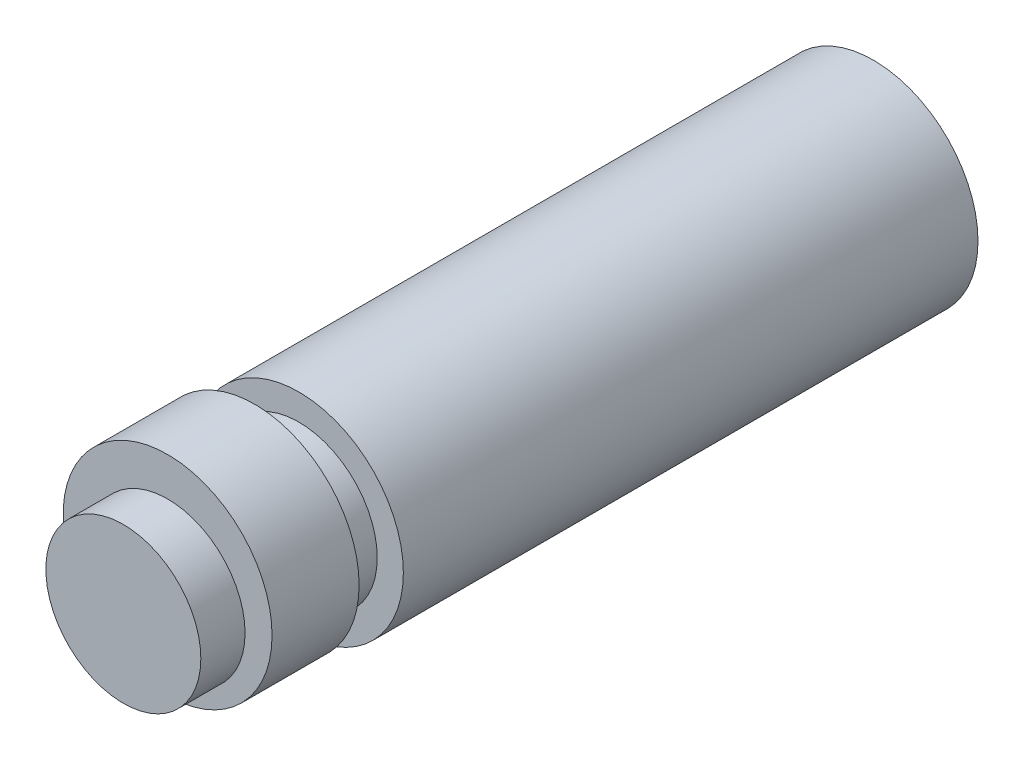
from build123d import *

# Parameters (mm, degrees)
SKETCH1_R           = 6
BOSS_EXTRUDE1_DEPTH = 33
SKETCH7_R           = 4.5
BOSS_EXTRUDE7_DEPTH = 2.54
SKETCH3_R           = 6
BOSS_EXTRUDE3_DEPTH = 5
SKETCH4_R           = 4.45
BOSS_EXTRUDE4_DEPTH = 2.54
CUT_EXTRUDE1_DEPTH  = 31.5


with BuildPart() as part:
    # Sketch1 → Boss-Extrude1 (new body)
    with BuildSketch(Plane.XY):
        Circle(SKETCH1_R)
    extrude(amount=BOSS_EXTRUDE1_DEPTH)

    # Sketch7 → Boss-Extrude7 (add)
    with BuildSketch(Plane.XY.offset(33)):
        Circle(SKETCH7_R)
    extrude(amount=BOSS_EXTRUDE7_DEPTH)

    # Sketch3 → Boss-Extrude3 (add)
    with BuildSketch(Plane.XY.offset(35.54)):
        with Locations((0, 0.6604)):
            Circle(SKETCH3_R)
    extrude(amount=BOSS_EXTRUDE3_DEPTH)

    # Sketch4 → Boss-Extrude4 (add)
    with BuildSketch(Plane.XY.offset(40.54)):
        Circle(SKETCH4_R)
    extrude(amount=BOSS_EXTRUDE4_DEPTH)

    # Sketch5 → Cut-Extrude1 (cut)
    with BuildSketch(Plane(origin=(0, 0, 0), x_dir=(-1, 0, 0), z_dir=(0, 0, -1))):
        with BuildLine():
            Line((-1.075, 5.09246155), (-1.075, 3.98246155))
            ThreePointArc((-1.075, 3.98246155), (0, 4.125), (1.075, 3.98246155))
            Line((1.075, 3.98246155), (1.075, 5.09246155))
            Line((1.075, 5.09246155), (-1.075, 5.09246155))
        make_face()
        with BuildLine():
            ThreePointArc((1.075, 3.98246155), (0, 4.125), (-1.075, 3.98246155))
            Line((-1.075, 3.98246155), (1.075, 3.98246155))
        make_face()
        with BuildLine():
            Line((1.075, 3.98246155), (-1.075, 3.98246155))
            ThreePointArc((-1.075, 3.98246155), (-2.50811184, -3.274904579), (4.125, 0))
            ThreePointArc((4.125, 0), (3.274904579, 2.50811184), (1.075, 3.98246155))
        make_face()
    extrude(amount=-CUT_EXTRUDE1_DEPTH, mode=Mode.SUBTRACT)


solid = part.part
